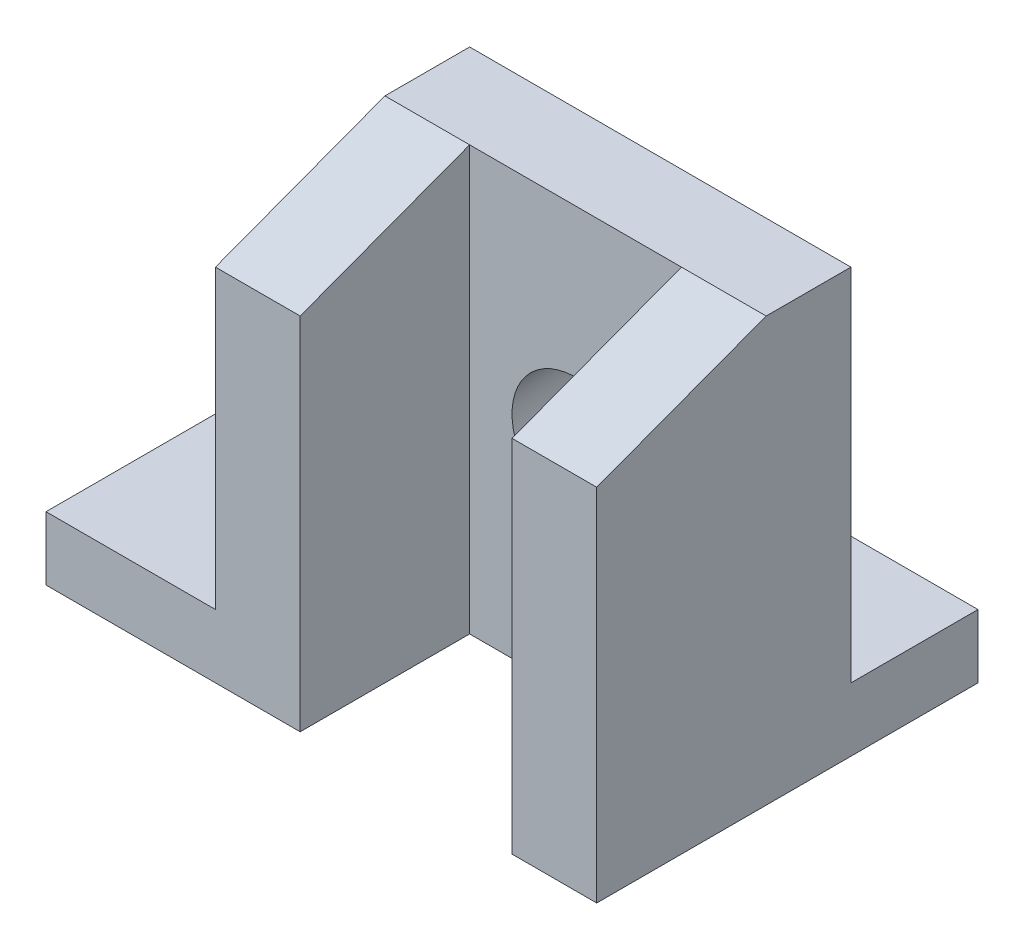
from build123d import *

# Parameters (mm, degrees)
SKETCH1_W           = 36
SKETCH1_H           = 40
SKETCH1_R           = 6
BOSS_EXTRUDE1_DEPTH = 8
BOSS_EXTRUDE2_START = 10
BOSS_EXTRUDE2_DEPTH = 8
SKETCH3_W           = 8
SKETCH3_H           = 16
BOSS_EXTRUDE3_DEPTH = 4
SKETCH5_W           = 36
SKETCH5_H           = 6
BOSS_EXTRUDE4_DEPTH = 16
SKETCH7_W           = 12
SKETCH7_H           = 6
BOSS_EXTRUDE5_DEPTH = 36


with BuildPart() as part:
    # Sketch1 → Boss-Extrude1 (new body)
    with BuildSketch(Plane.XY):
        Rectangle(SKETCH1_W, SKETCH1_H)
        Circle(SKETCH1_R, mode=Mode.SUBTRACT)
    extrude(amount=-BOSS_EXTRUDE1_DEPTH)

    # Sketch2 → Boss-Extrude2 (add, through all)
    with BuildSketch(Plane(origin=(0, 0, 0), x_dir=(0, 0, -1), z_dir=(1, 0, 0)).offset(BOSS_EXTRUDE2_START)):
        Polygon((0, 20), (-16, 14), (-16, -20), (0, -20), align=None)
    boss_extrude2 = extrude(amount=BOSS_EXTRUDE2_DEPTH)

    # Mirror1: Boss-Extrude2 across plane
    add(boss_extrude2.mirror(Plane(origin=(0, 0, 0), x_dir=(0, 0, 1), z_dir=(1, 0, 0))))

    # Sketch3 → Boss-Extrude3 (add)
    with BuildSketch(Plane.ZY.offset(18)):
        with Locations((8, 0)):
            Rectangle(SKETCH3_W, SKETCH3_H)
    extrude(amount=BOSS_EXTRUDE3_DEPTH)

    # Sketch5 → Boss-Extrude4 (add)
    with BuildSketch(Plane(origin=(-34, 0, 0), x_dir=(0, 0, -1), z_dir=(1, 0, 0))):
        with Locations((2, -17)):
            Rectangle(SKETCH5_W, SKETCH5_H)
    extrude(amount=BOSS_EXTRUDE4_DEPTH)

    # Sketch7 → Boss-Extrude5 (add, through all)
    with BuildSketch(Plane(origin=(-18, 0, 0), x_dir=(0, 0, -1), z_dir=(1, 0, 0))):
        with Locations((14, -17)):
            Rectangle(SKETCH7_W, SKETCH7_H)
    extrude(amount=BOSS_EXTRUDE5_DEPTH)


solid = part.part
